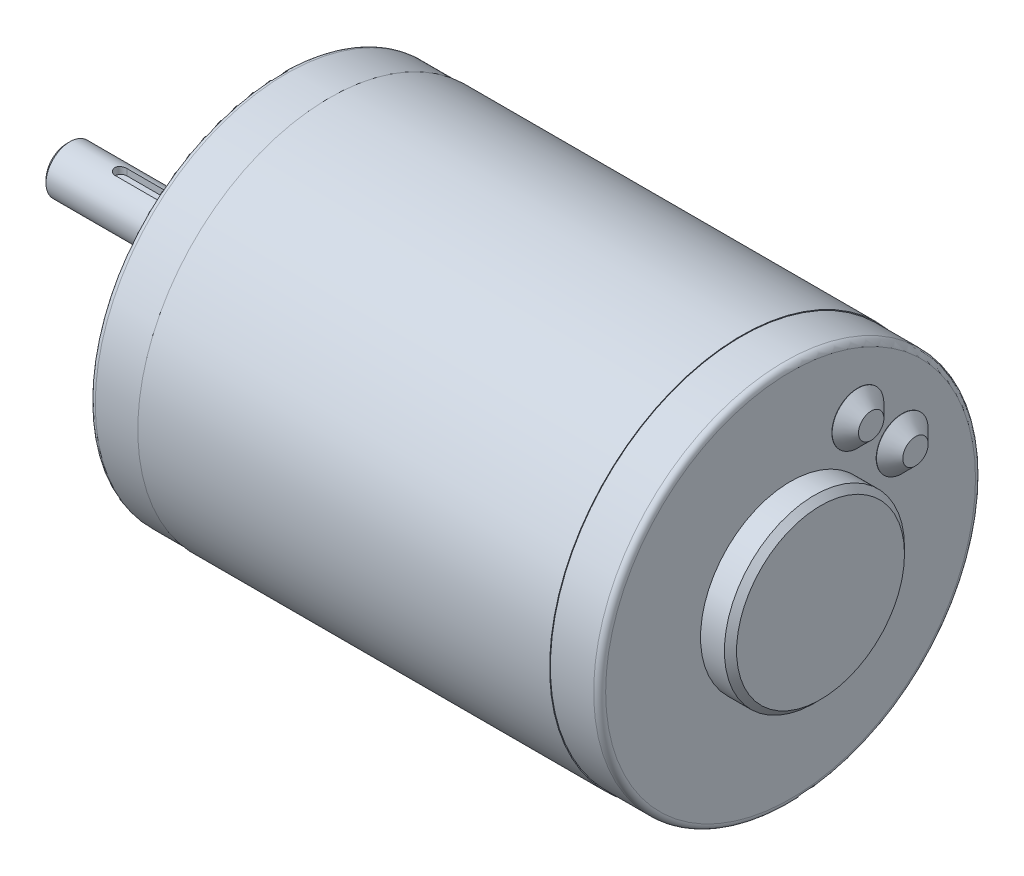
from build123d import *

# Parameters (mm, degrees)
SKETCH1_W                  = 68.7568
SKETCH1_H                  = 32.004
SKETCH2_R                  = 31.877
BOSS_EXTRUDE1_DEPTH        = 8.2296
SKETCH3_R                  = 15.0368
BOSS_EXTRUDE2_DEPTH        = 5
BOSS_EXTRUDE3_START        = 8.2296
SKETCH4_R                  = 31.877
BOSS_EXTRUDE3_DEPTH        = 8.2296
SKETCH5_R                  = 9.525
BOSS_EXTRUDE4_DEPTH        = 4
SKETCH6_R                  = 4
BOSS_EXTRUDE5_DEPTH        = 31.6
CUT_EXTRUDE1_REACH         = 103.855
CUT_EXTRUDE1_END_RADIUS    = 4
M3_5_CLEARANCE_HOLE1_D     = 4.0386
M3_5_CLEARANCE_HOLE1_DEPTH = 13.6144
M3_5_CLEARANCE_HOLE1_TIP   = 1.213317848
CHAMFER1_SIZE              = 1.016
CHAMFER2_SIZE              = 0.5
FILLET1_R                  = 1


with BuildPart() as part:
    # Sketch1 → Revolve1 (revolve)
    with BuildSketch(Plane.XY, mode=Mode.PRIVATE) as revolve1_sk:
        with Locations((42.608, 16.002)):
            Rectangle(SKETCH1_W, SKETCH1_H)
    revolve(revolve1_sk.sketch.rotate(Axis((8.2296, 0, 0), (1, 0, 0)), 270), axis=Axis((8.2296, 0, 0), (1, 0, 0)))

    # Sketch2 → Boss-Extrude1 (add)
    with BuildSketch(Plane(origin=(76.9864, 0, 0), x_dir=(0, 0, -1), z_dir=(1, 0, 0))):
        Circle(SKETCH2_R)
    extrude(amount=BOSS_EXTRUDE1_DEPTH)

    # Sketch3 → Boss-Extrude2 (add)
    with BuildSketch(Plane(origin=(85.216, 0, 0), x_dir=(0, 0, -1), z_dir=(1, 0, 0))):
        Circle(SKETCH3_R)
    extrude(amount=BOSS_EXTRUDE2_DEPTH)

    # Sketch4 → Boss-Extrude3 (add)
    with BuildSketch(Plane.ZY.offset(-8.2296).offset(BOSS_EXTRUDE3_START)):
        with Locations(Location((0, 0, 0), (0, 0, 180))):
            Circle(SKETCH4_R)
    extrude(amount=-BOSS_EXTRUDE3_DEPTH)

    # Sketch5 → Boss-Extrude4 (add)
    with BuildSketch(Plane.ZY):
        Circle(SKETCH5_R)
    extrude(amount=BOSS_EXTRUDE4_DEPTH)

    # Sketch6 → Boss-Extrude5 (add)
    with BuildSketch(Plane.ZY.offset(4)):
        Circle(SKETCH6_R)
    extrude(amount=BOSS_EXTRUDE5_DEPTH)

    # Cut-Extrude1: up to this cylinder (the profile starts inside it)
    cut_extrude1_end = Plane(origin=(-16.85, 0, 0), z_dir=(1, 0, 0)) * Cylinder(CUT_EXTRUDE1_END_RADIUS, 216.71, mode=Mode.PRIVATE)
    # Sketch7 → Cut-Extrude1 (cut, up to the surface)
    with BuildSketch(Plane.XZ.offset(-2.8), mode=Mode.PRIVATE) as cut_extrude1_sk1:
        with BuildLine():
            Line((-7.1, 1), (-26.6, 1))
            ThreePointArc((-26.6, 1), (-27.6, 0), (-26.6, -1))
            Line((-26.6, -1), (-7.1, -1))
            ThreePointArc((-7.1, -1), (-6.1, 0), (-7.1, 1))
        make_face()
    cut_extrude1_tool1 = extrude(cut_extrude1_sk1.sketch, amount=-CUT_EXTRUDE1_REACH, mode=Mode.PRIVATE) & cut_extrude1_end
    add(cut_extrude1_tool1.solids().sort_by_distance((-16.85, 2.8, 0))[0], mode=Mode.SUBTRACT)

    # Sketch8 → Revolve2 (revolve)
    with BuildSketch(Plane.XY.offset(-18.607090683), mode=Mode.PRIVATE) as revolve2_sk:
        Polygon((85.216, 15.525359639), (85.216, 11.207359639), (87.4639, 11.207359639), (87.4639, 13.325359639), (85.2639, 15.525359639), align=None)
    revolve(revolve2_sk.sketch.rotate(Axis((85.216, 11.207359639, -18.607090683), (1, 0, 0)), 270), axis=Axis((85.216, 11.207359639, -18.607090683), (1, 0, 0)))

    # Sketch9 → Revolve3 (revolve)
    with BuildSketch(Plane.XY.offset(-11.207359639), mode=Mode.PRIVATE) as revolve3_sk:
        Polygon((85.216, 22.925090683), (85.216, 18.607090683), (87.4639, 18.607090683), (87.4639, 20.725090683), (85.2639, 22.925090683), align=None)
    revolve(revolve3_sk.sketch.rotate(Axis((85.216, 18.607090683, -11.207359639), (1, 0, 0)), 270), axis=Axis((85.216, 18.607090683, -11.207359639), (1, 0, 0)))

    # M3.5 Clearance Hole1
    with Locations(Plane.ZY):
        with Locations((0, 25.4), (0, -25.4)):
            Hole(M3_5_CLEARANCE_HOLE1_D / 2, depth=M3_5_CLEARANCE_HOLE1_DEPTH)
            with Locations((0, 0, -(M3_5_CLEARANCE_HOLE1_DEPTH + M3_5_CLEARANCE_HOLE1_TIP / 2))):  # 118° drill point
                Cone(0, M3_5_CLEARANCE_HOLE1_D / 2, M3_5_CLEARANCE_HOLE1_TIP, mode=Mode.SUBTRACT)

    # Chamfer1
    chamfer1_edges = [part.edges().sort_by_distance(p)[0] for p in [
        (90.216, 0, 15.0368),
        (-4, 0, -9.525),
    ]]
    chamfer(chamfer1_edges, length=CHAMFER1_SIZE)

    # Chamfer2
    chamfer2_edges = [part.edges().sort_by_distance(p)[0] for p in [
        (-35.6, 0, -4),
    ]]
    chamfer(chamfer2_edges, length=CHAMFER2_SIZE)

    # Fillet1
    fillet1_edges = [part.edges().sort_by_distance(p)[0] for p in [
        (0, 0, 31.877),
        (85.216, 0, 31.877),
    ]]
    fillet(fillet1_edges, radius=FILLET1_R)


solid = part.part
